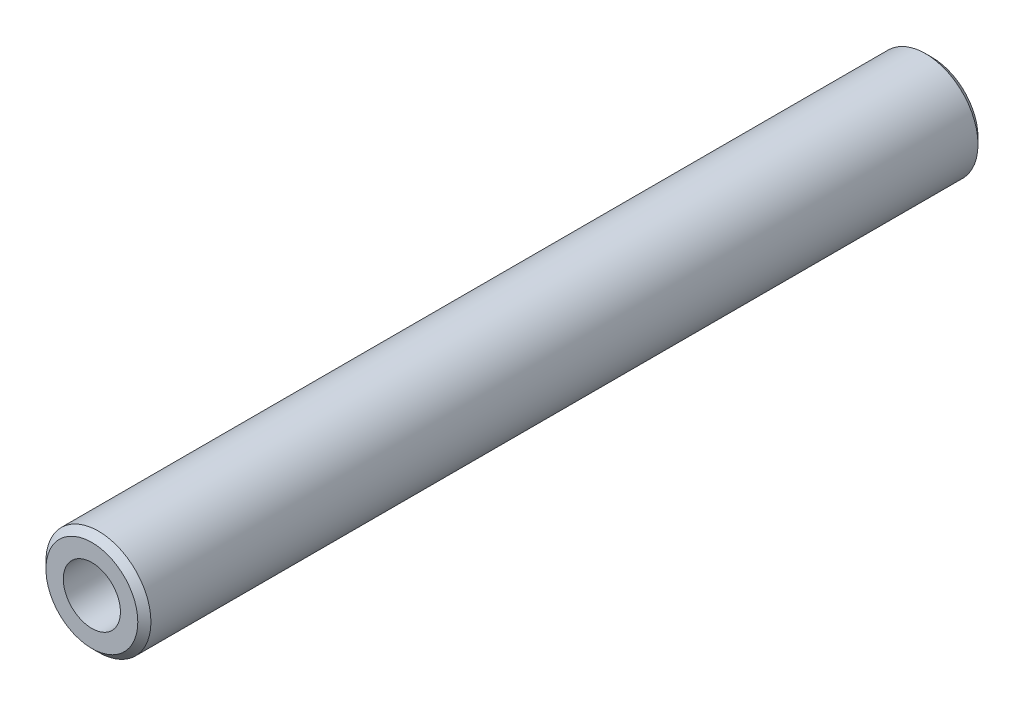
from build123d import *

# Parameters (mm, degrees)
SKETCH1_R                               = 3.175
BOSS_EXTRUDE1_DEPTH                     = 25.4
TAP_DRILL_FOR_8_32_TAP1_D               = 3.4544
TAP_DRILL_FOR_8_32_TAP1_DEPTH           = 6.35
TAP_DRILL_FOR_8_32_TAP1_TIP             = 1.037806461
TAP_DRILL_FOR_8_32_TAP1_ON_FACE_2_D     = 3.4544
TAP_DRILL_FOR_8_32_TAP1_ON_FACE_2_DEPTH = 6.35
TAP_DRILL_FOR_8_32_TAP1_ON_FACE_2_TIP   = 1.037806461
CHAMFER1_SIZE                           = 0.396875


with BuildPart() as part:
    # Sketch1 → Boss-Extrude1 (new, symmetric)
    with BuildSketch(Plane.XY):
        Circle(SKETCH1_R)
    extrude(amount=BOSS_EXTRUDE1_DEPTH, both=True)

    # Tap Drill for #8-32 Tap1
    with Locations(Plane.XY.offset(25.4)):
        with Locations((0, 0)):
            Hole(TAP_DRILL_FOR_8_32_TAP1_D / 2, depth=TAP_DRILL_FOR_8_32_TAP1_DEPTH)
            with Locations((0, 0, -(TAP_DRILL_FOR_8_32_TAP1_DEPTH + TAP_DRILL_FOR_8_32_TAP1_TIP / 2))):  # 118° drill point
                Cone(0, TAP_DRILL_FOR_8_32_TAP1_D / 2, TAP_DRILL_FOR_8_32_TAP1_TIP, mode=Mode.SUBTRACT)

    # Tap Drill for #8-32 Tap1 on face 2
    with Locations(Plane(origin=(0, 0, -25.4), x_dir=(-1, 0, 0), z_dir=(0, 0, -1))):
        with Locations((0, 0)):
            Hole(TAP_DRILL_FOR_8_32_TAP1_ON_FACE_2_D / 2, depth=TAP_DRILL_FOR_8_32_TAP1_ON_FACE_2_DEPTH)
            with Locations((0, 0, -(TAP_DRILL_FOR_8_32_TAP1_ON_FACE_2_DEPTH + TAP_DRILL_FOR_8_32_TAP1_ON_FACE_2_TIP / 2))):  # 118° drill point
                Cone(0, TAP_DRILL_FOR_8_32_TAP1_ON_FACE_2_D / 2, TAP_DRILL_FOR_8_32_TAP1_ON_FACE_2_TIP, mode=Mode.SUBTRACT)

    # Chamfer1
    chamfer1_edges = [part.edges().sort_by_distance(p)[0] for p in [
        (-3.175, 0, -25.4),
        (-3.175, 0, 25.4),
    ]]
    chamfer(chamfer1_edges, length=CHAMFER1_SIZE)


solid = part.part
